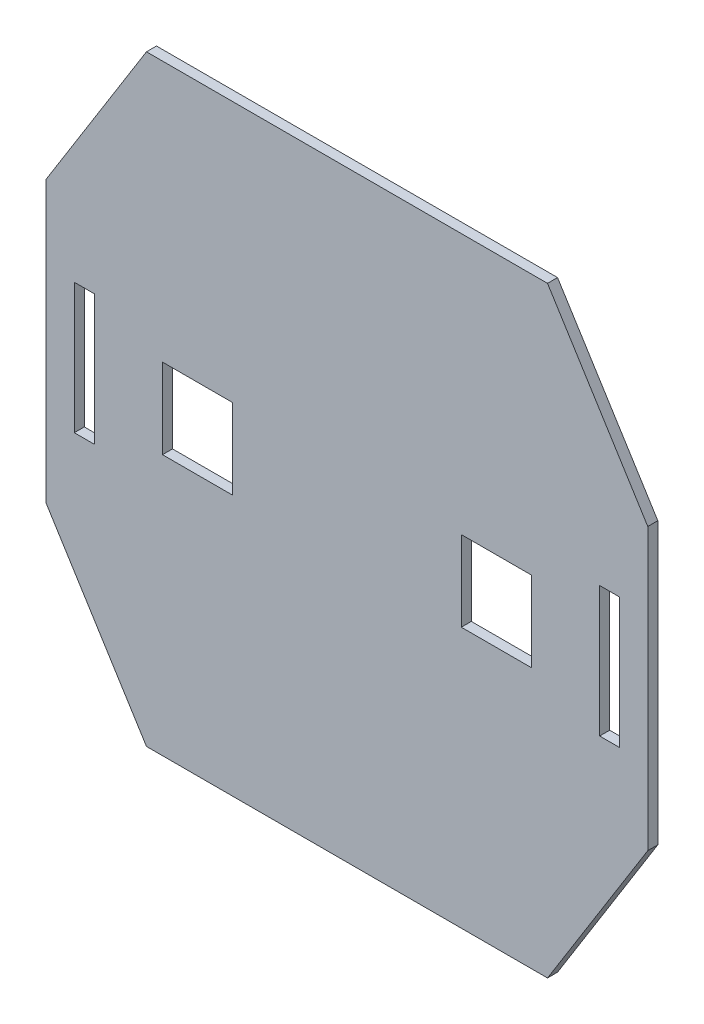
from build123d import *

# Parameters (mm, degrees)
BOSS_EXTRU_1_DEPTH      = 5
ESQUISSE5_W             = 35
ESQUISSE5_H             = 40
ESQUISSE5_W_2           = 10
ESQUISSE5_H_2           = 65
ENL_V_MAT_EXTRU_1_DEPTH = 20


with BuildPart() as part:
    # Esquisse3 → Boss.-Extru.1 (new body)
    with BuildSketch(Plane.XY):
        Polygon((-100, 150), (-150, 70), (-150, -70), (-100, -150), (100, -150), (150, -70), (150, 70), (100, 150), align=None)
    extrude(amount=BOSS_EXTRU_1_DEPTH)

    # Esquisse5 → Enlèv. mat.-Extru.1 (cut)
    with BuildSketch(Plane.XY.offset(5)):
        with Locations((-74.5, 0)):
            Rectangle(ESQUISSE5_W, ESQUISSE5_H)
        with Locations((74.5, 0)):
            Rectangle(ESQUISSE5_W, ESQUISSE5_H)
        with Locations((-130.993475803, 0)):
            Rectangle(ESQUISSE5_W_2, ESQUISSE5_H_2)
        with Locations((130.993475803, 0)):
            Rectangle(ESQUISSE5_W_2, ESQUISSE5_H_2)
    extrude(amount=-ENL_V_MAT_EXTRU_1_DEPTH, mode=Mode.SUBTRACT)


solid = part.part
